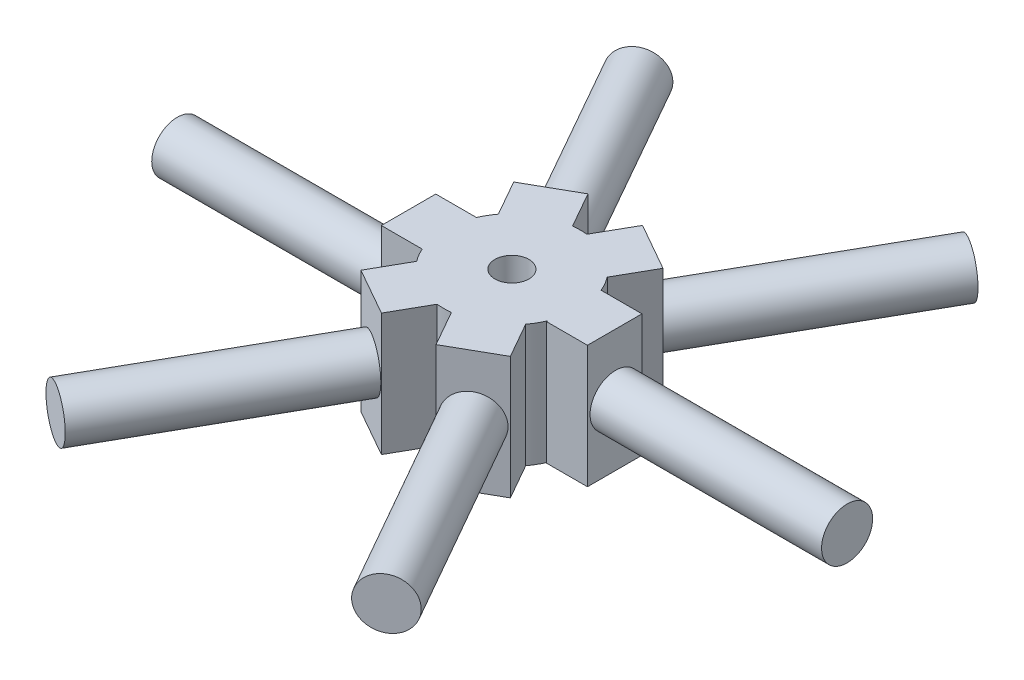
from build123d import *

# Parameters (mm, degrees)
SKETCH1_R                = 12.7
SKETCH1_R_2              = 3.175
BOSS_EXTRUDE1_DEPTH      = 22.86
SKETCH4_W                = 7.62
SKETCH4_H                = 10.16
BOSS_EXTRUDE2_DEPTH      = 22.86
CUT_EXTRUDE1_DEPTH       = 51.830375937
CUT_EXTRUDE1_DEPTH_BACK  = 51.830375937
SKETCH8_R                = 3
CUT_EXTRUDE2_DEPTH       = 54.699688086
CUT_EXTRUDE2_DEPTH_BACK  = 54.699688086
SKETCH9_R                = 3
CUT_EXTRUDE3_DEPTH       = 54.699688086
CUT_EXTRUDE3_DEPTH_BACK  = 54.699688086
SKETCH10_R               = 3
BOSS_EXTRUDE3_DEPTH      = 40.64
BOSS_EXTRUDE3_DEPTH_BACK = 2.54
SKETCH14_R               = 4.7625
BOSS_EXTRUDE4_DEPTH      = 40.64
BOSS_EXTRUDE4_DEPTH_BACK = 2.54
SKETCH15_R               = 4.7625
BOSS_EXTRUDE5_DEPTH      = 40.64
BOSS_EXTRUDE5_DEPTH_BACK = 2.54
SKETCH16_R               = 4.7625
BOSS_EXTRUDE6_DEPTH      = 40.64
BOSS_EXTRUDE6_DEPTH_BACK = 2.54
SKETCH17_R               = 4.7625
SKETCH18_R               = 4.7625
BOSS_EXTRUDE7_DEPTH      = 43.18
SKETCH19_R               = 4.7625
BOSS_EXTRUDE8_DEPTH      = 43.18


with BuildPart() as part:
    # Sketch1 → Boss-Extrude1 (new body)
    with BuildSketch(Plane(origin=(0, 0, 0), x_dir=(1, 0, 0), z_dir=(0, 1, 0))):
        with Locations(Location((0, 0, 0), (0, 0, 270))):
            Circle(SKETCH1_R)
        with Locations(Location((0, 0, 0), (0, 0, 270))):
            Circle(SKETCH1_R_2, mode=Mode.SUBTRACT)
    extrude(amount=BOSS_EXTRUDE1_DEPTH)

    # Sketch4 → Boss-Extrude2 (add)
    with BuildSketch(Plane(origin=(0, 0, 0), x_dir=(1, 0, 0), z_dir=(0, 1, 0))):
        with Locations((15.520261251, -0.164739944)):
            Rectangle(SKETCH4_W, SKETCH4_H)
        with Locations((-15.431900524, -0.040686304)):
            Rectangle(SKETCH4_W, SKETCH4_H)
        Polygon((-13.918276287, 14.248707215), (-10.16, 7.62), (-1.321723713, 12.63103505), (-5.08, 19.259742265), align=None)
        Polygon((5.105090281, 19.253106901), (1.338180271, 12.62930218), (10.169919899, 7.606755501), (13.936829909, 14.230560221), align=None)
        Polygon((-1.321723713, -12.63103505), (-10.16, -7.62), (-13.918276287, -14.248707215), (-5.08, -19.259742265), align=None)
        Polygon((10.169919899, -7.606755501), (1.338180271, -12.62930218), (5.105090281, -19.253106901), (13.936829909, -14.230560221), align=None)
    extrude(amount=BOSS_EXTRUDE2_DEPTH)

    # Sketch8 → Cut-Extrude1 (cut, two sides: drawn at the far end of the back side and taken through both)
    with BuildSketch(Plane.ZY.offset(21.781900524).offset(-CUT_EXTRUDE1_DEPTH_BACK)):
        with Locations((0, 11.43)):
            Circle(SKETCH8_R)
    extrude(amount=CUT_EXTRUDE1_DEPTH + CUT_EXTRUDE1_DEPTH_BACK, mode=Mode.SUBTRACT)

    # Sketch9 → Cut-Extrude2 (cut, two sides: drawn at the far end of the back side and taken through both)
    with BuildSketch(Plane(origin=(10.776596765, 0, -18.949768468), x_dir=(-0.8692657113802013, 0, -0.49434514564084964), z_dir=(0.49434514564084964, 0, -0.8692657113802013)).offset(-CUT_EXTRUDE2_DEPTH_BACK)):
        with Locations(Location((0, 11.43, 0), (0, 0, 180))):
            Circle(SKETCH9_R)
    extrude(amount=CUT_EXTRUDE2_DEPTH + CUT_EXTRUDE2_DEPTH_BACK, mode=Mode.SUBTRACT)

    # Sketch10 → Cut-Extrude3 (cut, two sides: drawn at the far end of the back side and taken through both)
    with BuildSketch(Plane(origin=(10.776596765, 0, 18.949768468), x_dir=(0.8692657113802004, 0, -0.494345145640851), z_dir=(0.494345145640851, 0, 0.8692657113802004)).offset(-CUT_EXTRUDE3_DEPTH_BACK)):
        with Locations((0, 11.43)):
            Circle(SKETCH10_R)
    extrude(amount=CUT_EXTRUDE3_DEPTH + CUT_EXTRUDE3_DEPTH_BACK, mode=Mode.SUBTRACT)

    # Sketch14 → Boss-Extrude3 (add, two sides: drawn at the far end of the back side and taken through both)
    with BuildSketch(Plane(origin=(21.870261251, 0, 0), x_dir=(0, 0, -1), z_dir=(1, 0, 0)).offset(-BOSS_EXTRUDE3_DEPTH_BACK)):
        with Locations((0, 11.43)):
            Circle(SKETCH14_R)
    extrude(amount=BOSS_EXTRUDE3_DEPTH + BOSS_EXTRUDE3_DEPTH_BACK)

    # Sketch15 → Boss-Extrude4 (add, two sides: drawn at the far end of the back side and taken through both)
    with BuildSketch(Plane(origin=(10.776596765, 0, 18.949768468), x_dir=(0.8692657113802004, 0, -0.494345145640851), z_dir=(0.494345145640851, 0, 0.8692657113802004)).offset(-BOSS_EXTRUDE4_DEPTH_BACK)):
        with Locations((0, 11.43)):
            Circle(SKETCH15_R)
    extrude(amount=BOSS_EXTRUDE4_DEPTH + BOSS_EXTRUDE4_DEPTH_BACK)

    # Sketch16 → Boss-Extrude5 (add, two sides: drawn at the far end of the back side and taken through both)
    with BuildSketch(Plane.ZY.offset(21.781900524).offset(-BOSS_EXTRUDE5_DEPTH_BACK)):
        with Locations(Location((0, 11.43, 0), (0, 0, 180))):
            Circle(SKETCH16_R)
    extrude(amount=BOSS_EXTRUDE5_DEPTH + BOSS_EXTRUDE5_DEPTH_BACK)

    # Sketch17 → Boss-Extrude6 (add, two sides: drawn at the far end of the back side and taken through both)
    with BuildSketch(Plane(origin=(10.776596765, 0, -18.949768468), x_dir=(-0.8692657113802013, 0, -0.49434514564084964), z_dir=(0.49434514564084964, 0, -0.8692657113802013)).offset(-BOSS_EXTRUDE6_DEPTH_BACK)):
        with Locations((0, 11.43)):
            Circle(SKETCH17_R)
    extrude(amount=BOSS_EXTRUDE6_DEPTH + BOSS_EXTRUDE6_DEPTH_BACK)

    # Sketch18 → Boss-Extrude7 (add)
    with BuildSketch(Plane(origin=(-9.499138144, 0, -16.75422474), x_dir=(-0.8699090833946802, 0, 0.4932121111929708), z_dir=(-0.4932121111929708, 0, -0.8699090833946802))):
        with Locations((0, 11.43)):
            Circle(SKETCH18_R)
    extrude(amount=BOSS_EXTRUDE7_DEPTH)

    # Sketch19 → Boss-Extrude8 (add)
    with BuildSketch(Plane(origin=(-9.499138144, 0, 16.75422474), x_dir=(0.8699090833947006, 0, 0.4932121111929346), z_dir=(-0.4932121111929346, 0, 0.8699090833947006))):
        with Locations((0, 11.43)):
            Circle(SKETCH19_R)
    extrude(amount=BOSS_EXTRUDE8_DEPTH)


solid = part.part
